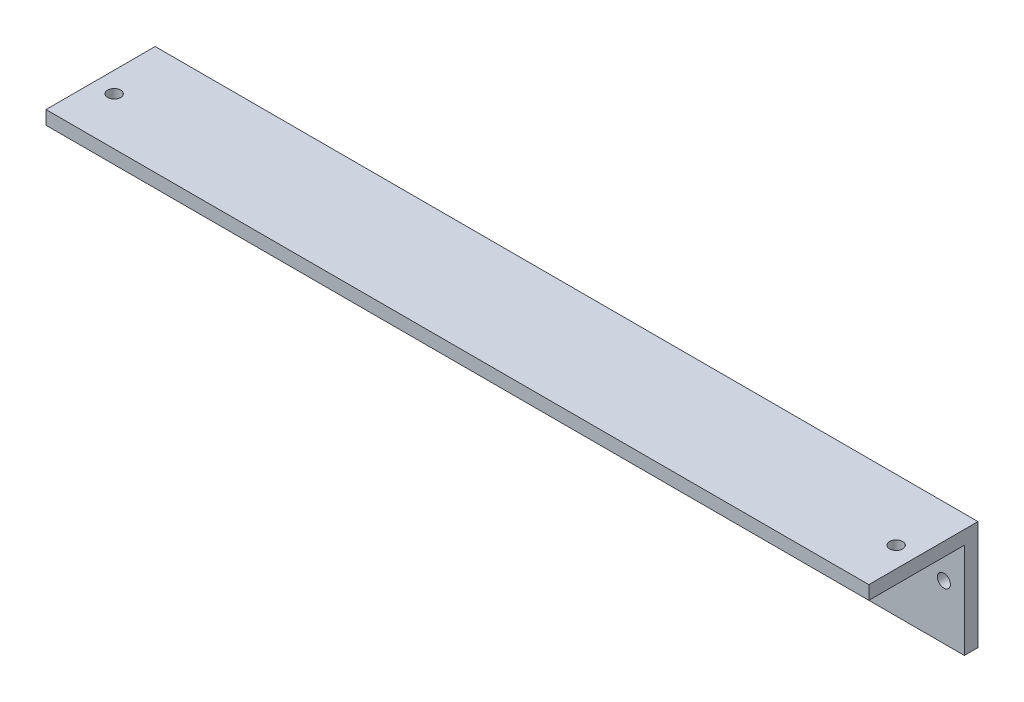
from build123d import *

# Parameters (mm, degrees)
CROQUIS1_W              = 633.04
CROQUIS1_H              = 80
CROQUIS1_R              = 4.7625
SALIENTE_EXTRUIR1_DEPTH = 10
CROQUIS2_W              = 633.04
CROQUIS2_H              = 10
SALIENTE_EXTRUIR2_DEPTH = 70
CROQUIS3_R              = 4.7625
CROQUIS3_R_2            = 4.765
CORTAR_EXTRUIR1_DEPTH   = 642.903140357
CORTAR_EXTRUIR2_DEPTH   = 15
CORTAR_EXTRUIR3_DEPTH   = 15


with BuildPart() as part:
    # Croquis1 → Saliente-Extruir1 (new body)
    with BuildSketch(Plane.XY):
        with Locations((316.52, 40)):
            Rectangle(CROQUIS1_W, CROQUIS1_H)
        with Locations((30, 40)):
            Circle(CROQUIS1_R, mode=Mode.SUBTRACT)
        with Locations((603.04, 40)):
            Circle(CROQUIS1_R, mode=Mode.SUBTRACT)
    extrude(amount=SALIENTE_EXTRUIR1_DEPTH)

    # Croquis2 → Saliente-Extruir2 (add)
    with BuildSketch(Plane.XY.offset(10)):
        with Locations((316.52, 75)):
            Rectangle(CROQUIS2_W, CROQUIS2_H)
    extrude(amount=SALIENTE_EXTRUIR2_DEPTH)

    # Croquis3 → Cortar-Extruir1 (cut, through all)
    with BuildSketch(Plane.XZ.offset(-70)):
        with Locations((30, 45)):
            Circle(CROQUIS3_R)
        with Locations((603.04, 45)):
            Circle(CROQUIS3_R_2)
    extrude(amount=-CORTAR_EXTRUIR1_DEPTH, mode=Mode.SUBTRACT)

    # Croquis4 → Cortar-Extruir2 (cut)
    with BuildSketch(Plane(origin=(633.04, 0, 0), x_dir=(0, 0, -1), z_dir=(1, 0, 0))):
        Polygon((-80, 70), (-80, 80), (0, 80), (0, 0), (-10, 0), (-10, 70), align=None)
    extrude(amount=-CORTAR_EXTRUIR2_DEPTH, mode=Mode.SUBTRACT)

    # Croquis5 → Cortar-Extruir3 (cut)
    with BuildSketch(Plane.ZY):
        Polygon((80, 70), (80, 80), (0, 80), (0, 0), (10, 0), (10, 70), align=None)
    extrude(amount=-CORTAR_EXTRUIR3_DEPTH, mode=Mode.SUBTRACT)


solid = part.part
